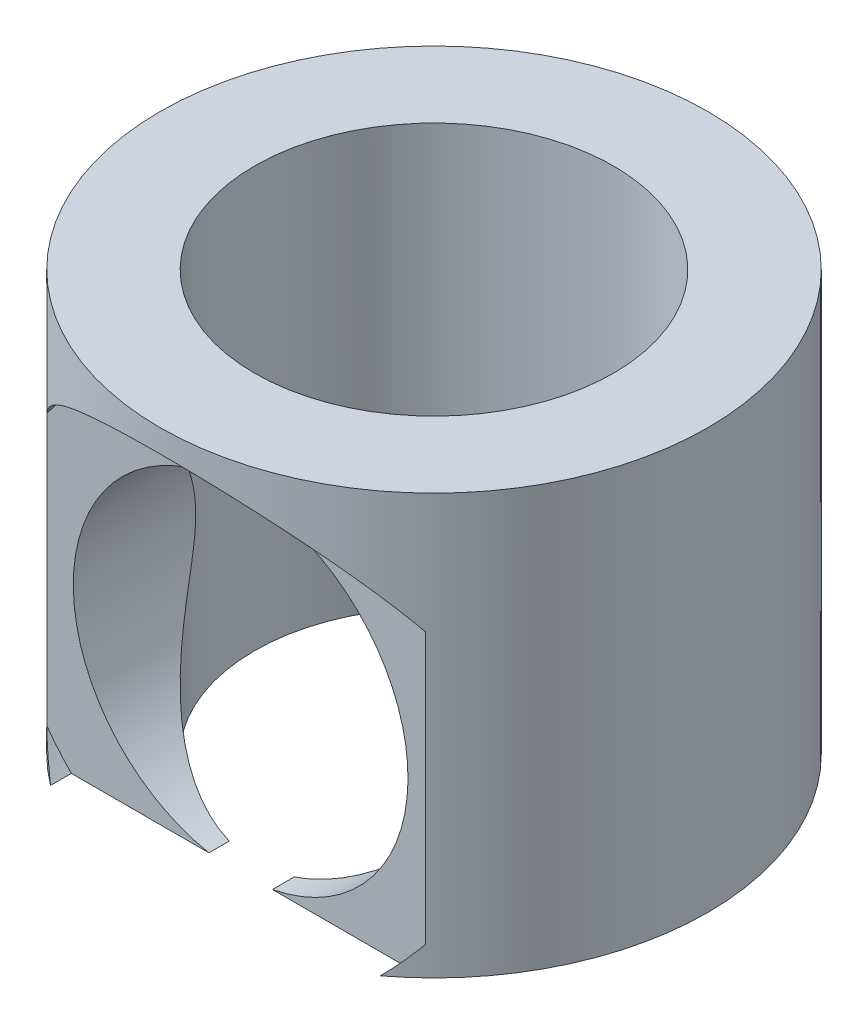
from build123d import *

# Parameters (mm, degrees)
SKETCH1_R               = 9
SKETCH1_R_2             = 5.9
BOSS_EXTRUDE1_DEPTH     = 19.8
CUT_EXTRUDE5_START      = 6.5
SKETCH3_R               = 7.65
CUT_EXTRUDE5_DEPTH      = 18.038054295
CUT_EXTRUDE6_DEPTH      = 27.707489752
CUT_EXTRUDE6_DEPTH_BACK = 7
SKETCH6_R               = 5.5
SKETCH7_R               = 12.932797278
CUT_EXTRUDE7_DEPTH      = 10


with BuildPart() as part:
    # Sketch1 → Boss-Extrude1 (new body)
    with BuildSketch(Plane(origin=(0, 0, 0), x_dir=(1, 0, 0), z_dir=(0, 1, 0))):
        with Locations(Location((0, 0, 0), (0, 0, 270))):
            Circle(SKETCH1_R)
        with Locations(Location((0, 0, 0), (0, 0, 270))):
            Circle(SKETCH1_R_2, mode=Mode.SUBTRACT)
    extrude(amount=-BOSS_EXTRUDE1_DEPTH)

    # Sketch3 → Cut-Extrude5 (cut, through all)
    with BuildSketch(Plane.XY.offset(CUT_EXTRUDE5_START)):
        with Locations((0, -8.4)):
            Circle(SKETCH3_R)
    extrude(amount=CUT_EXTRUDE5_DEPTH, mode=Mode.SUBTRACT)

    # Sketch6 → Cut-Extrude6 (cut, two sides: drawn at the far end of the back side and taken through both)
    with BuildSketch(Plane.XY.offset(6.5).offset(-CUT_EXTRUDE6_DEPTH_BACK)):
        with Locations(Location((0.145476138, -8.4, 0), (0, 0, 91.515662264))):
            Circle(SKETCH6_R)
    extrude(amount=CUT_EXTRUDE6_DEPTH + CUT_EXTRUDE6_DEPTH_BACK, mode=Mode.SUBTRACT)

    # Sketch7 → Cut-Extrude7 (cut)
    with BuildSketch(Plane(origin=(0, -13.8, 0), x_dir=(-1, 0, 0), z_dir=(0, -1, 0))):
        Circle(SKETCH7_R)
    extrude(amount=CUT_EXTRUDE7_DEPTH, mode=Mode.SUBTRACT)


solid = part.part
